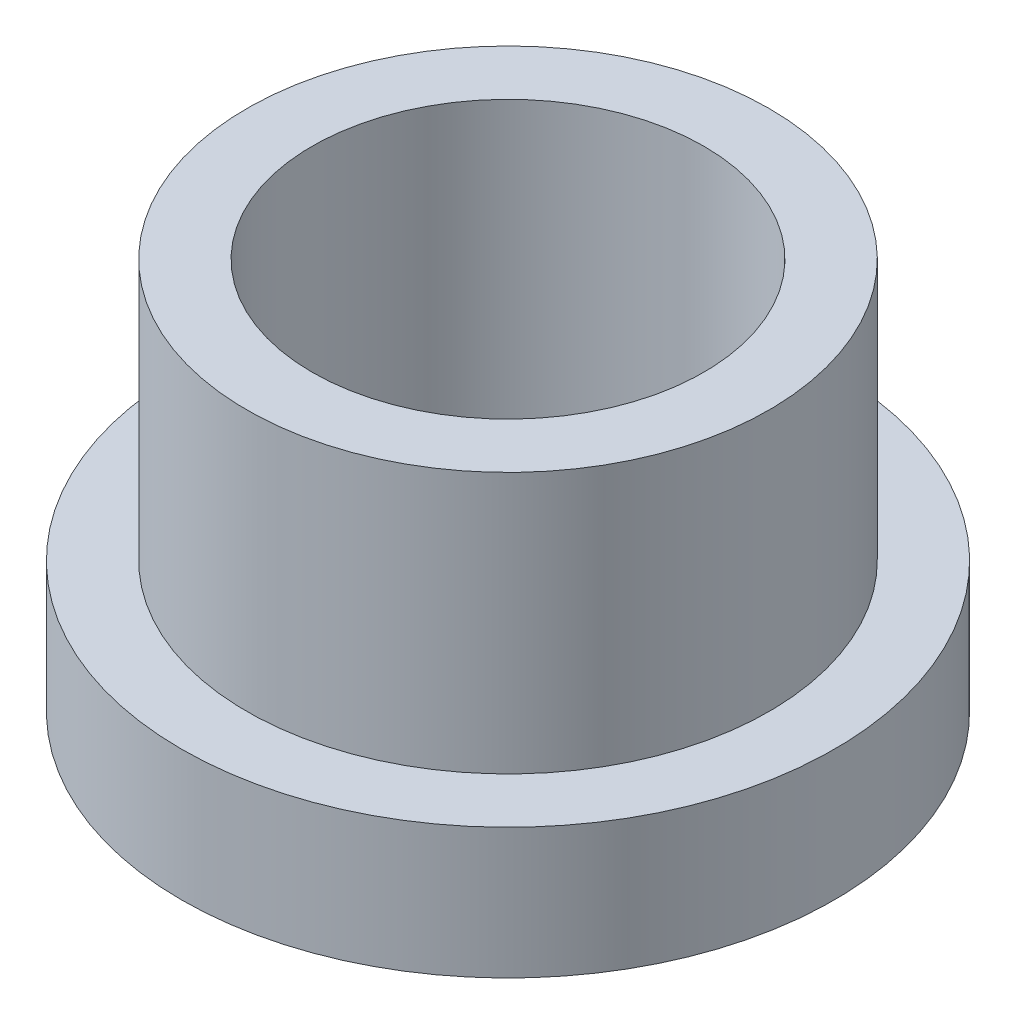
from build123d import *

# Parameters (mm, degrees)
SKETCH2_R           = 6.35
SKETCH2_R_2         = 4.7625
BOSS_EXTRUDE1_DEPTH = 9.525
SKETCH3_R           = 7.9375
SKETCH3_R_2         = 6.35
BOSS_EXTRUDE2_DEPTH = 3.175


with BuildPart() as part:
    # Sketch2 → Boss-Extrude1 (new body)
    with BuildSketch(Plane(origin=(0, 0, 0), x_dir=(1, 0, 0), z_dir=(0, 1, 0))):
        with Locations(Location((0, 0, 0), (0, 0, 90))):
            Circle(SKETCH2_R)
        with Locations(Location((0, 0, 0), (0, 0, 90))):
            Circle(SKETCH2_R_2, mode=Mode.SUBTRACT)
    extrude(amount=BOSS_EXTRUDE1_DEPTH)

    # Sketch3 → Boss-Extrude2 (add)
    with BuildSketch(Plane(origin=(0, 0, 0), x_dir=(1, 0, 0), z_dir=(0, 1, 0))):
        with Locations(Location((0, 0, 0), (0, 0, 270))):
            Circle(SKETCH3_R)
        with Locations(Location((0, 0, 0), (0, 0, 90))):
            Circle(SKETCH3_R_2, mode=Mode.SUBTRACT)
    extrude(amount=BOSS_EXTRUDE2_DEPTH)


solid = part.part
